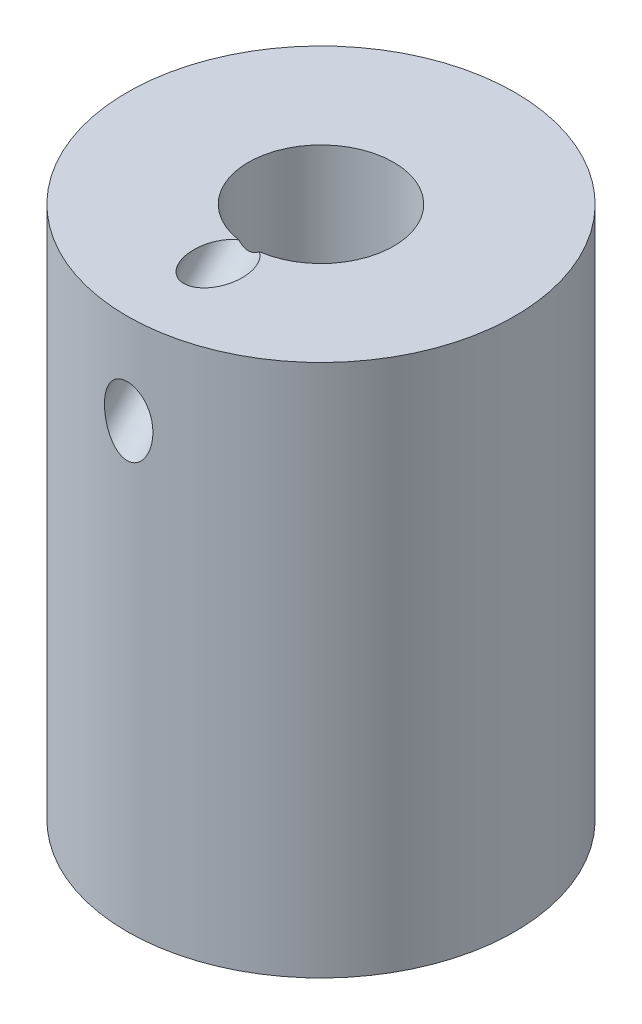
from build123d import *

# Parameters (mm, degrees)
SKETCH2_R                    = 12.7
BOSS_EXTRUDE1_DEPTH          = 34.925
F_3_8_0_375_DIAMETER_HOLE1_D = 9.525
F_1_8_0_125_DIAMETER_HOLE1_D = 3.175


with BuildPart() as part:
    # Sketch1 → Revolve1 (revolve)
    with BuildSketch(Plane.XY, mode=Mode.PRIVATE) as revolve1_sk:
        Polygon((0, 0), (0, 38.1), (-8.796078082, 0), align=None)
    revolve(revolve1_sk.sketch.rotate(Axis((0, 0, 0), (0, 1, 0)), 270), axis=Axis((0, 0, 0), (0, 1, 0)))


with BuildPart() as body_2:
    # Sketch2 → Boss-Extrude1 (new body)
    with BuildSketch(Plane.XZ):
        with Locations(Location((0, 0, 0), (0, 0, 270))):
            Circle(SKETCH2_R)
    extrude(amount=-BOSS_EXTRUDE1_DEPTH)

    # Combine1: cut part
    add(part.part, mode=Mode.SUBTRACT)

    # 3/8 (0.375) Diameter Hole1 (through all)
    with Locations(Plane(origin=(0, 34.925, 0), x_dir=(1, 0, 0), z_dir=(0, 1, 0))):
        with Locations((0, 0)):
            Hole(F_3_8_0_375_DIAMETER_HOLE1_D / 2)

    # 1/8 (0.125) Diameter Hole1 (through all)
    with Locations(Plane(origin=(0, 0, 0), x_dir=(1, 0, 0), z_dir=(0, -0.7071067811865475, 0.7071067811865477))):
        with Locations((0, 29.466465397)):
            Hole(F_1_8_0_125_DIAMETER_HOLE1_D / 2)


solid = body_2.part
